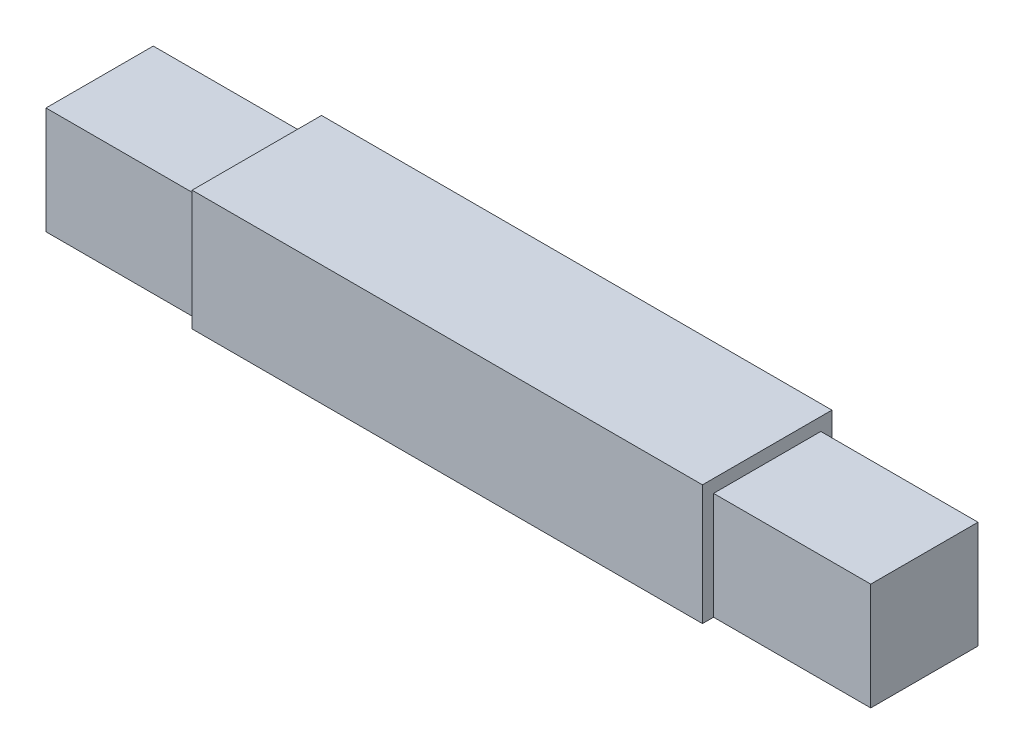
from build123d import *

# Parameters (mm, degrees)
SKETCH2_W             = 10.795
SKETCH2_H             = 7.366
BOSS_EXTRUDE1_DEPTH   = 7.366
BOSS_EXTRUDE1_2_DEPTH = 7.366
SKETCH2_4_W           = 35.052
SKETCH2_4_H           = 8.89
BOSS_EXTRUDE2_DEPTH   = 8.255


with BuildPart() as part:
    # Sketch2 → Boss-Extrude1 (new body)
    with BuildSketch(Plane(origin=(0, 0, 0), x_dir=(1, 0, 0), z_dir=(0, 1, 0))):
        with Locations((-22.9235, 0)):
            Rectangle(SKETCH2_W, SKETCH2_H)
    extrude(amount=BOSS_EXTRUDE1_DEPTH)



with BuildPart() as body_2:
    # Sketch2 → Boss-Extrude1 2 (new body)
    with BuildSketch(Plane(origin=(0, 0, 0), x_dir=(1, 0, 0), z_dir=(0, 1, 0))):
        with Locations((22.9235, 0)):
            Rectangle(SKETCH2_W, SKETCH2_H)
    extrude(amount=BOSS_EXTRUDE1_2_DEPTH)


with BuildPart() as part_1:
    add(part.part)

    add(body_2.part)  # Boss-Extrude2 merges body 2
    # Sketch2<4> → Boss-Extrude2 (add)
    with BuildSketch(Plane(origin=(0, 0, 0), x_dir=(1, 0, 0), z_dir=(0, 1, 0))):
        Rectangle(SKETCH2_4_W, SKETCH2_4_H)
    extrude(amount=BOSS_EXTRUDE2_DEPTH)


solid = part_1.part
